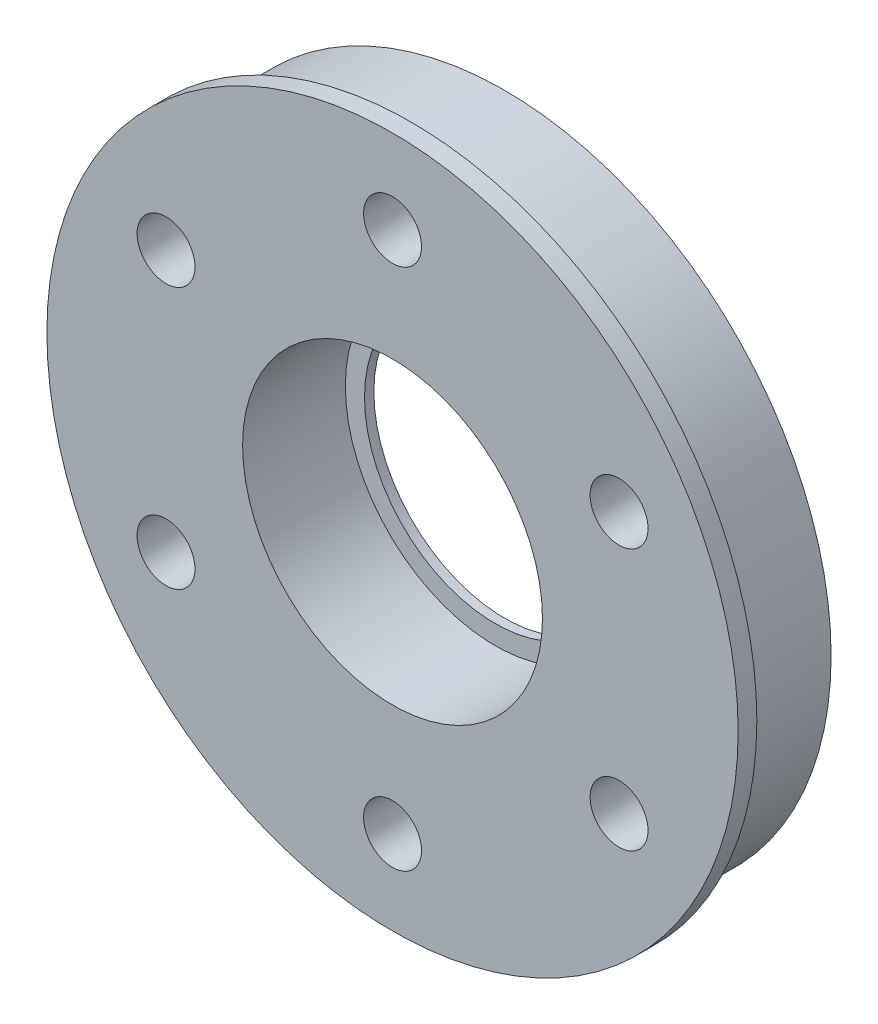
from build123d import *

# Parameters (mm, degrees)
SKETCH1_R           = 17.475
SKETCH1_R_2         = 8.025
BOSS_EXTRUDE1_DEPTH = 6
CUT_EXTRUDE1_START  = 6
SKETCH1_3_R         = 1.55
CUT_EXTRUDE1_DEPTH  = 4
BOSS_EXTRUDE2_START = 6
SKETCH2_R           = 18.5
SKETCH2_R_2         = 17.25
BOSS_EXTRUDE2_DEPTH = 1
SKETCH2_3_R         = 8.25
SKETCH2_3_R_2       = 7
BOSS_EXTRUDE3_DEPTH = 0.5


with BuildPart() as part:
    # Sketch1 → Boss-Extrude1 (new body)
    with BuildSketch(Plane.XY):
        Circle(SKETCH1_R)
        Circle(SKETCH1_R_2, mode=Mode.SUBTRACT)
    extrude(amount=BOSS_EXTRUDE1_DEPTH)

    # Sketch1<3> → Cut-Extrude1 (cut)
    with BuildSketch(Plane.XY.offset(CUT_EXTRUDE1_START)):
        with Locations((-12.124355653, 7)):
            Circle(SKETCH1_3_R)
        with BuildLine():
            ThreePointArc((0, 15.55), (-1.55, 14), (0, 12.45))
            Line((0, 12.45), (0, 15.55))
        make_face()
        with BuildLine():
            Line((0, 15.55), (0, 12.45))
            ThreePointArc((0, 12.45), (1.096015511, 12.903984489), (1.55, 14))
            ThreePointArc((1.55, 14), (1.096015511, 15.096015511), (0, 15.55))
        make_face()
        with Locations((12.124355653, 7)):
            Circle(SKETCH1_3_R)
        with Locations((12.124355653, -7)):
            Circle(SKETCH1_3_R)
        with Locations((0, -14)):
            Circle(SKETCH1_3_R)
        with Locations((-12.124355653, -7)):
            Circle(SKETCH1_3_R)
    extrude(amount=-CUT_EXTRUDE1_DEPTH, mode=Mode.SUBTRACT)

    # Sketch2 → Boss-Extrude2 (add)
    with BuildSketch(Plane.XY.offset(BOSS_EXTRUDE2_START)):
        Circle(SKETCH2_R)
        Circle(SKETCH2_R_2, mode=Mode.SUBTRACT)
    extrude(amount=-BOSS_EXTRUDE2_DEPTH)

    # Sketch2<3> → Boss-Extrude3 (add)
    with BuildSketch(Plane.XY):
        Circle(SKETCH2_3_R)
        Circle(SKETCH2_3_R_2, mode=Mode.SUBTRACT)
    extrude(amount=BOSS_EXTRUDE3_DEPTH)


solid = part.part
